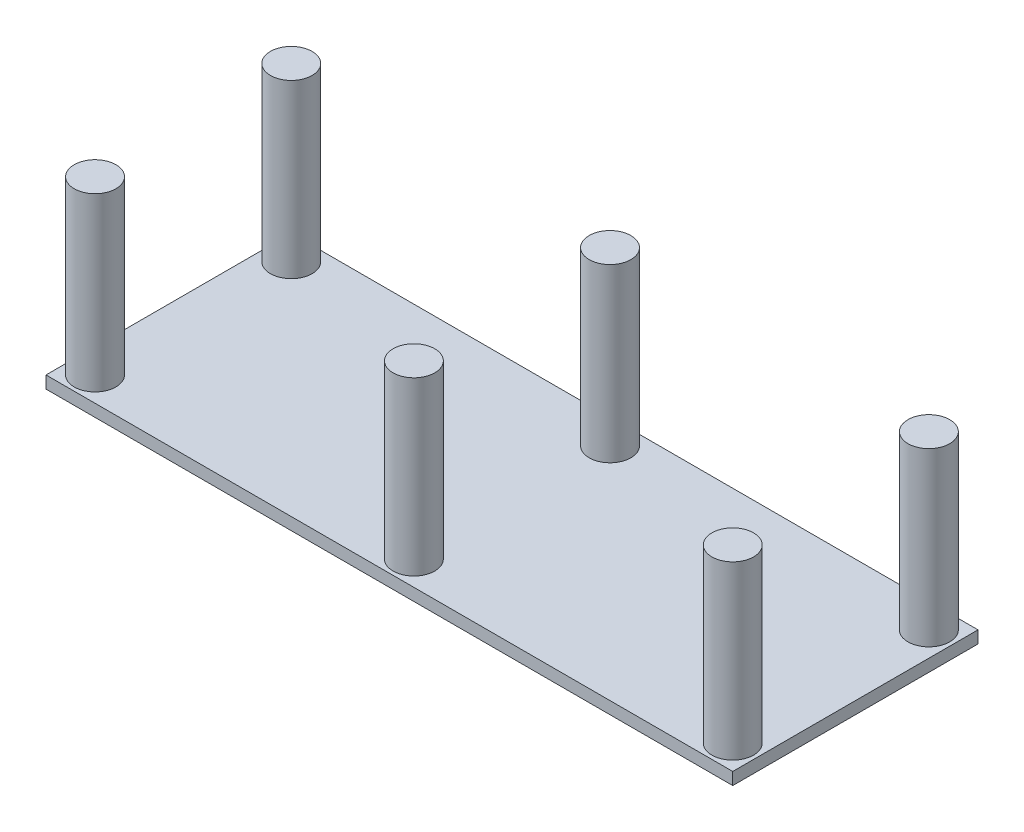
from build123d import *

# Parameters (mm, degrees)
IZIM1_W                     = 280
IZIM1_H                     = 100
Y_KSEKLIK_EKSTR_ZYON6_DEPTH = 5
IZIM16_R                    = 8.5
Y_KSEKLIK_EKSTR_ZYON7_DEPTH = 70


with BuildPart() as part:
    # Çizim1 → Yükseklik-Ekstrüzyon6 (new body)
    with BuildSketch(Plane(origin=(0, 0, 0), x_dir=(1, 0, 0), z_dir=(0, 1, 0))):
        with Locations((120, 30)):
            Rectangle(IZIM1_W, IZIM1_H)
    extrude(amount=Y_KSEKLIK_EKSTR_ZYON6_DEPTH)

    # Çizim16 → Yükseklik-Ekstrüzyon7 (add)
    with BuildSketch(Plane(origin=(0, 5, 0), x_dir=(1, 0, 0), z_dir=(0, 1, 0))):
        with Locations(Location((-10, 70, 0), (0, 0, 270))):
            Circle(IZIM16_R)
        with Locations(Location((-10, -10, 0), (0, 0, 90))):
            Circle(IZIM16_R)
        with Locations(Location((250, 69.966428456, 0), (0, 0, 90))):
            Circle(IZIM16_R)
        with Locations(Location((250, -10, 0), (0, 0, 270))):
            Circle(IZIM16_R)
        with Locations(Location((120, 69.966428456, 0), (0, 0, 270))):
            Circle(IZIM16_R)
        with Locations(Location((120, -10, 0), (0, 0, 270))):
            Circle(IZIM16_R)
    extrude(amount=Y_KSEKLIK_EKSTR_ZYON7_DEPTH)


solid = part.part
